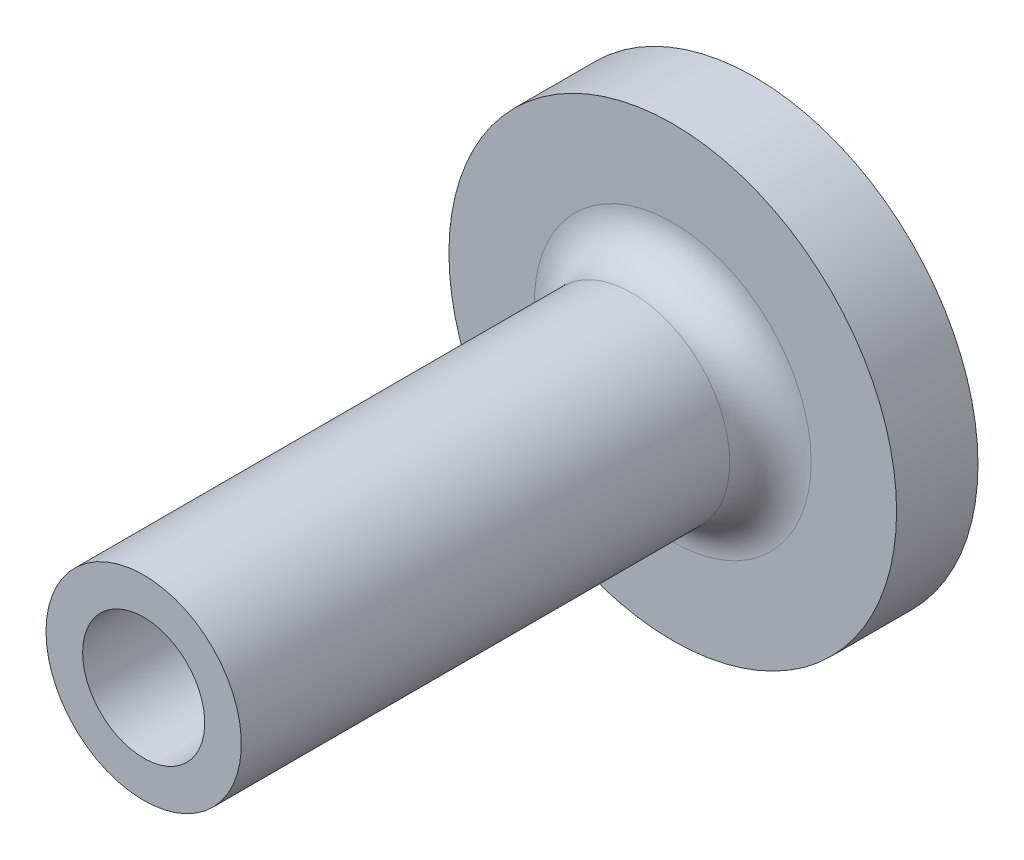
from build123d import *

# Parameters (mm, degrees)
ESQUISSE1_R        = 5.5
BOSS_EXTRU_1_DEPTH = 2
ESQUISSE2_R        = 2.4
ESQUISSE2_R_2      = 1.5
BOSS_EXTRU_2_DEPTH = 13
CONG_1_R           = 1


with BuildPart() as part:
    # Esquisse1 → Boss.-Extru.1 (new body)
    with BuildSketch(Plane.XY):
        Circle(ESQUISSE1_R)
    extrude(amount=BOSS_EXTRU_1_DEPTH)

    # Esquisse2 → Boss.-Extru.2 (add)
    with BuildSketch(Plane.XY.offset(2)):
        with Locations(Location((0, 0, 0), (0, 0, 180))):
            Circle(ESQUISSE2_R)
        with Locations(Location((0, 0, 0), (0, 0, 180))):
            Circle(ESQUISSE2_R_2, mode=Mode.SUBTRACT)
    extrude(amount=BOSS_EXTRU_2_DEPTH)

    # Congé1
    cong_1_edges = [part.edges().sort_by_distance(p)[0] for p in [
        (2.4, 0, 2),
    ]]
    fillet(cong_1_edges, radius=CONG_1_R)


solid = part.part
